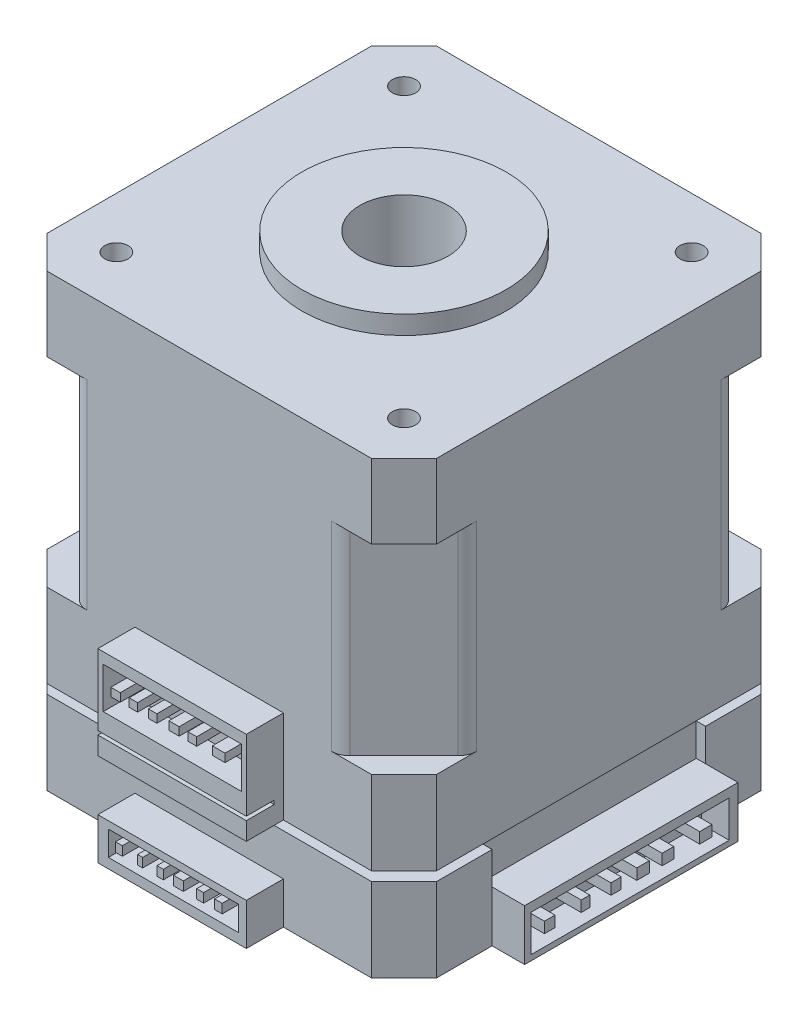
from build123d import *

# Parameters (mm, degrees)
SKETCH_1_R             = 0.5
EXTRUDE_1_DEPTH        = 8
EXTRUDE_2_DEPTH        = 21.5
EXTRUDE_3_DEPTH        = 9
SKETCH_4_R             = 3
EXTRUDE_4_DEPTH        = 10
EXTRUDE_5_DEPTH        = 9
HOLE_WIZARD_M3_1_D     = 2.5
HOLE_WIZARD_M3_1_DEPTH = 6.5
HOLE_WIZARD_M3_1_TIP   = 0.751075774
SKETCH_10_R            = 11
EXTRUDE_6_DEPTH        = 2
SKETCH_11_R            = 4.75
CUT_EXTRUDE_1_DEPTH    = 22
SKETCH_12_W            = 16
SKETCH_12_H            = 4
EXTRUDE_7_DEPTH        = 20
SKETCH_13_W            = 16
SKETCH_13_H            = 5.5
CUT_EXTRUDE_2_DEPTH    = 4
SKETCH_14_W            = 16
SKETCH_14_H            = 0.410991047
CUT_EXTRUDE_3_DEPTH    = 3
SKETCH_15_W            = 14.932119024
SKETCH_15_H            = 4.421120872
SKETCH_15_W_2          = 1.018591574
SKETCH_15_H_2          = 0.888558607
SKETCH_15_W_3          = 0.910230768
SKETCH_15_W_4          = 1.105280218
SKETCH_15_W_5          = 0.95357509
SKETCH_15_W_6          = 1.365346151
SKETCH_15_W_7          = 14.029885449
SKETCH_15_H_3          = 2.651802524
SKETCH_15_W_8          = 0.733211095
SKETCH_15_H_4          = 0.986717219
SKETCH_15_W_9          = 0.549388278
SKETCH_15_W_10         = 0.68897455
SKETCH_15_W_11         = 1.063804501
SKETCH_15_W_12         = 0.745609389
SKETCH_15_W_13         = 0.832542653
CUT_EXTRUDE_4_DEPTH    = 3
SKETCH_16_W            = 3.5
SKETCH_16_H            = 23
EXTRUDE_8_DEPTH        = 5.5
SKETCH_17_W            = 23
SKETCH_17_H            = 3.5
CUT_EXTRUDE_5_DEPTH    = 1
SKETCH_18_W            = 21.377042826
SKETCH_18_H            = 3.957601196
SKETCH_18_W_2          = 1.139309436
SKETCH_18_H_2          = 1.169291262
SKETCH_18_W_3          = 0.929436644
SKETCH_18_W_4          = 1.109327608
SKETCH_18_W_5          = 1.349182226
SKETCH_18_W_6          = 1.259236744
SKETCH_18_W_7          = 1.319200399
CUT_EXTRUDE_6_DEPTH    = 3


with BuildPart() as part:
    # 草图1 → 凸台-拉伸1 (new body)
    with BuildSketch(Plane(origin=(0, 0, 0), x_dir=(1, 0, 0), z_dir=(0, 1, 0))):
        Polygon((-21, 17.5), (-17.5, 21), (17.5, 21), (21, 17.5), (21, -17.5), (17.5, -21), (-17.5, -21), (-21, -17.5), align=None)
        with Locations(Location((-15.5, 15.5, 0), (0, 0, 270))):
            Circle(SKETCH_1_R, mode=Mode.SUBTRACT)
        with Locations(Location((15.5, 15.5, 0), (0, 0, 270))):
            Circle(SKETCH_1_R, mode=Mode.SUBTRACT)
        with Locations(Location((-15.5, -15.5, 0), (0, 0, 270))):
            Circle(SKETCH_1_R, mode=Mode.SUBTRACT)
        with Locations(Location((15.5, -15.5, 0), (0, 0, 270))):
            Circle(SKETCH_1_R, mode=Mode.SUBTRACT)
    extrude(amount=EXTRUDE_1_DEPTH)

    # 草图2 → 凸台-拉伸2 (add)
    with BuildSketch(Plane.XZ):
        with BuildLine():
            Line((-20.414213562, 14.585786438), (-14.585786438, 20.414213562))
            ThreePointArc((-14.585786438, 20.414213562), (-13.93693974, 20.847759065), (-13.171572875, 21))
            Line((-13.171572875, 21), (13.171572875, 21))
            ThreePointArc((13.171572875, 21), (13.93693974, 20.847759065), (14.585786438, 20.414213562))
            Line((14.585786438, 20.414213562), (20.414213562, 14.585786438))
            ThreePointArc((20.414213562, 14.585786438), (20.847759065, 13.93693974), (21, 13.171572875))
            Line((21, 13.171572875), (21, -13.171572875))
            ThreePointArc((21, -13.171572875), (20.847759065, -13.93693974), (20.414213562, -14.585786438))
            Line((20.414213562, -14.585786438), (14.585786438, -20.414213562))
            ThreePointArc((14.585786438, -20.414213562), (13.93693974, -20.847759065), (13.171572875, -21))
            Line((13.171572875, -21), (-13.171572875, -21))
            ThreePointArc((-13.171572875, -21), (-13.93693974, -20.847759065), (-14.585786438, -20.414213562))
            Line((-14.585786438, -20.414213562), (-20.414213562, -14.585786438))
            ThreePointArc((-20.414213562, -14.585786438), (-20.847759065, -13.93693974), (-21, -13.171572875))
            Line((-21, -13.171572875), (-21, 13.171572875))
            ThreePointArc((-21, 13.171572875), (-20.847759065, 13.93693974), (-20.414213562, 14.585786438))
        make_face()
    extrude(amount=EXTRUDE_2_DEPTH)

    # 草图3 → 凸台-拉伸3 (add)
    with BuildSketch(Plane.XZ.offset(21.5)):
        Polygon((-21, 17.5), (-17.5, 21), (17.5, 21), (21, 17.5), (21, -17.5), (17.5, -21), (-17.5, -21), (-21, -17.5), align=None)
    extrude(amount=EXTRUDE_3_DEPTH)

    # 草图4 → 凸台-拉伸4 (add)
    with BuildSketch(Plane.XZ.offset(30.5)):
        with Locations(Location((-15.5, 15.5, 0), (0, 0, 90))):
            Circle(SKETCH_4_R)
        with Locations(Location((15.5, 15.5, 0), (0, 0, 90))):
            Circle(SKETCH_4_R)
        with Locations(Location((-15.5, -15.5, 0), (0, 0, 90))):
            Circle(SKETCH_4_R)
        with Locations(Location((15.5, -15.5, 0), (0, 0, 90))):
            Circle(SKETCH_4_R)
    extrude(amount=EXTRUDE_4_DEPTH)

    # 草图5 → 凸台-拉伸5 (add)
    with BuildSketch(Plane.XZ.offset(40.5)):
        Polygon((-21, 17.5), (-17.5, 21), (17.5, 21), (21, 17.5), (21, -17.5), (17.5, -21), (-17.5, -21), (-21, -17.5), align=None)
    extrude(amount=-EXTRUDE_5_DEPTH)

    # M3 螺纹孔的螺纹孔钻头1
    with Locations(Plane(origin=(0, 8, 0), x_dir=(1, 0, 0), z_dir=(0, 1, 0))):
        with Locations((-15.5, 15.5), (15.5, 15.5), (-15.5, -15.5), (15.5, -15.5)):
            Hole(HOLE_WIZARD_M3_1_D / 2, depth=HOLE_WIZARD_M3_1_DEPTH)
            with Locations((0, 0, -(HOLE_WIZARD_M3_1_DEPTH + HOLE_WIZARD_M3_1_TIP / 2))):  # 118° drill point
                Cone(0, HOLE_WIZARD_M3_1_D / 2, HOLE_WIZARD_M3_1_TIP, mode=Mode.SUBTRACT)

    # 草图10 → 凸台-拉伸6 (add)
    with BuildSketch(Plane(origin=(0, 8, 0), x_dir=(1, 0, 0), z_dir=(0, 1, 0))):
        with Locations(Location((0, 0, 0), (0, 0, 90))):
            Circle(SKETCH_10_R)
    extrude(amount=EXTRUDE_6_DEPTH)

    # 草图11 → 切除-拉伸1 (cut)
    with BuildSketch(Plane(origin=(0, 10, 0), x_dir=(1, 0, 0), z_dir=(0, 1, 0))):
        with Locations(Location((0, 0, 0), (0, 0, 270))):
            Circle(SKETCH_11_R)
    extrude(amount=-CUT_EXTRUDE_1_DEPTH, mode=Mode.SUBTRACT)

    # 草图12 → 凸台-拉伸7 (add)
    with BuildSketch(Plane.XZ.offset(40.5)):
        with Locations((0, 23)):
            Rectangle(SKETCH_12_W, SKETCH_12_H)
    extrude(amount=-EXTRUDE_7_DEPTH)

    # 草图13 → 切除-拉伸2 (cut)
    with BuildSketch(Plane.XY.offset(25)):
        with Locations((0, -33.25)):
            Rectangle(SKETCH_13_W, SKETCH_13_H)
    extrude(amount=-CUT_EXTRUDE_2_DEPTH, mode=Mode.SUBTRACT)

    # 草图14 → 切除-拉伸3 (cut)
    with BuildSketch(Plane.XY.offset(25)):
        with Locations((0, -28.356047823)):
            Rectangle(SKETCH_14_W, SKETCH_14_H)
    extrude(amount=-CUT_EXTRUDE_3_DEPTH, mode=Mode.SUBTRACT)

    # 草图15 → 切除-拉伸4 (cut)
    # profile 1 of 2: a face of its own
    with BuildSketch(Plane.XY.offset(25)):
        with Locations((0.04248549, -23.883266216)):
            Rectangle(SKETCH_15_W, SKETCH_15_H)
        with Locations((-6.090736112, -23.850757974)):
            Rectangle(SKETCH_15_W_2, SKETCH_15_H_2, mode=Mode.SUBTRACT)
        with Locations((-4.172749851, -23.850757974)):
            Rectangle(SKETCH_15_W_3, SKETCH_15_H_2, mode=Mode.SUBTRACT)
        with Locations((-2.092222382, -23.850757974)):
            Rectangle(SKETCH_15_W_3, SKETCH_15_H_2, mode=Mode.SUBTRACT)
        with Locations((0.215862779, -23.850757974)):
            Rectangle(SKETCH_15_W_4, SKETCH_15_H_2, mode=Mode.SUBTRACT)
        with Locations((2.177193362, -23.850757974)):
            Rectangle(SKETCH_15_W_5, SKETCH_15_H_2, mode=Mode.SUBTRACT)
        with Locations((5.027082552, -23.850757974)):
            Rectangle(SKETCH_15_W_6, SKETCH_15_H_2, mode=Mode.SUBTRACT)
    # profile 2 of 2: a face of its own
    with BuildSketch(Plane.XY.offset(25)):
        with Locations((0.146506967, -38.103976676)):
            Rectangle(SKETCH_15_W_7, SKETCH_15_H_3)
        with Locations((-5.724130565, -38.073141763)):
            Rectangle(SKETCH_15_W_8, SKETCH_15_H_4, mode=Mode.SUBTRACT)
        with Locations((-3.442940328, -38.073141763)):
            Rectangle(SKETCH_15_W_9, SKETCH_15_H_4, mode=Mode.SUBTRACT)
        with Locations((-1.292619723, -38.073141763)):
            Rectangle(SKETCH_15_W_10, SKETCH_15_H_4, mode=Mode.SUBTRACT)
        with Locations((0.678409218, -38.073141763)):
            Rectangle(SKETCH_15_W_11, SKETCH_15_H_4, mode=Mode.SUBTRACT)
        with Locations((3.026785602, -38.073141763)):
            Rectangle(SKETCH_15_W_12, SKETCH_15_H_4, mode=Mode.SUBTRACT)
        with Locations((4.98758832, -38.073141763)):
            Rectangle(SKETCH_15_W_13, SKETCH_15_H_4, mode=Mode.SUBTRACT)
    extrude(amount=-CUT_EXTRUDE_4_DEPTH, mode=Mode.SUBTRACT)

    # 草图16 → 凸台-拉伸8 (add)
    with BuildSketch(Plane.XZ.offset(40.5)):
        with Locations((22.75, 0)):
            Rectangle(SKETCH_16_W, SKETCH_16_H)
    extrude(amount=-EXTRUDE_8_DEPTH)

    # 草图17 → 切除-拉伸5 (cut)
    with BuildSketch(Plane(origin=(21, 0, 0), x_dir=(0, 0, -1), z_dir=(1, 0, 0))):
        with Locations((0, -33.25)):
            Rectangle(SKETCH_17_W, SKETCH_17_H)
    extrude(amount=-CUT_EXTRUDE_5_DEPTH, mode=Mode.SUBTRACT)

    # 草图18 → 切除-拉伸6 (cut)
    with BuildSketch(Plane(origin=(24.5, 0, 0), x_dir=(0, 0, -1), z_dir=(1, 0, 0))):
        with Locations((-0.141025196, -37.937429966)):
            Rectangle(SKETCH_18_W, SKETCH_18_H)
        with Locations((-8.790782356, -38.102330016)):
            Rectangle(SKETCH_18_W_2, SKETCH_18_H_2, mode=Mode.SUBTRACT)
        with Locations((-4.938117555, -38.102330016)):
            Rectangle(SKETCH_18_W_3, SKETCH_18_H_2, mode=Mode.SUBTRACT)
        with Locations((-1.640116558, -38.102330016)):
            Rectangle(SKETCH_18_W_4, SKETCH_18_H_2, mode=Mode.SUBTRACT)
        with Locations((1.268120685, -38.102330016)):
            Rectangle(SKETCH_18_W_5, SKETCH_18_H_2, mode=Mode.SUBTRACT)
        with Locations((3.951494223, -38.102330016)):
            Rectangle(SKETCH_18_W_6, SKETCH_18_H_2, mode=Mode.SUBTRACT)
        with Locations((8.029022729, -38.102330016)):
            Rectangle(SKETCH_18_W_7, SKETCH_18_H_2, mode=Mode.SUBTRACT)
    extrude(amount=-CUT_EXTRUDE_6_DEPTH, mode=Mode.SUBTRACT)


solid = part.part
